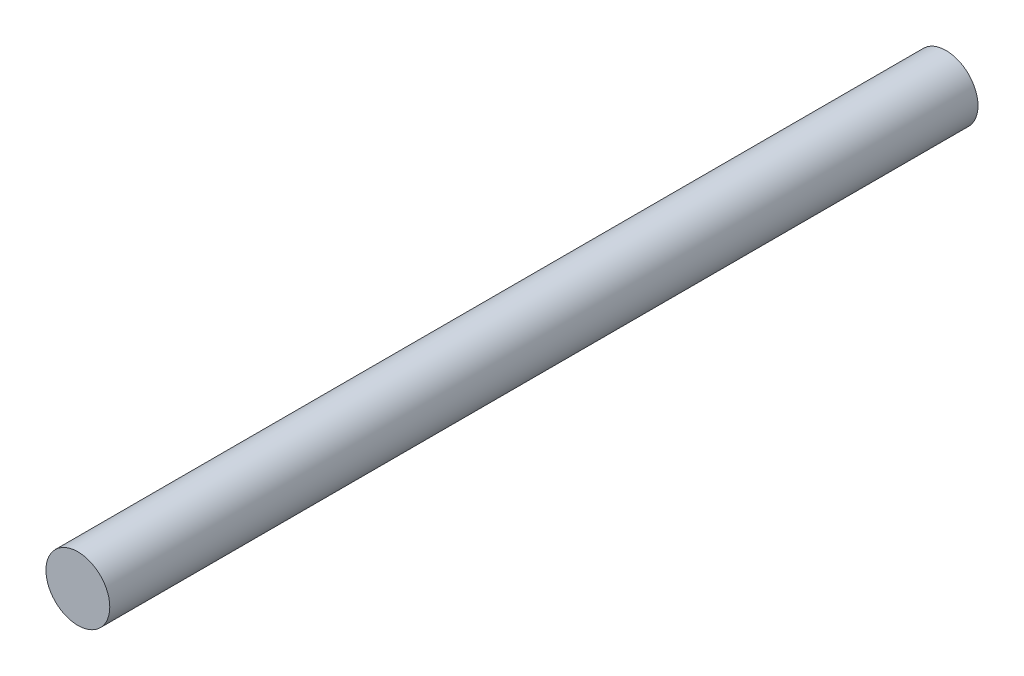
from build123d import *

# Parameters (mm, degrees)
SKETCH1_R           = 2.5
BOSS_EXTRUDE1_DEPTH = 68


with BuildPart() as part:
    # Sketch1 → Boss-Extrude1 (new body)
    with BuildSketch(Plane.XY):
        Circle(SKETCH1_R)
    extrude(amount=BOSS_EXTRUDE1_DEPTH)


solid = part.part
